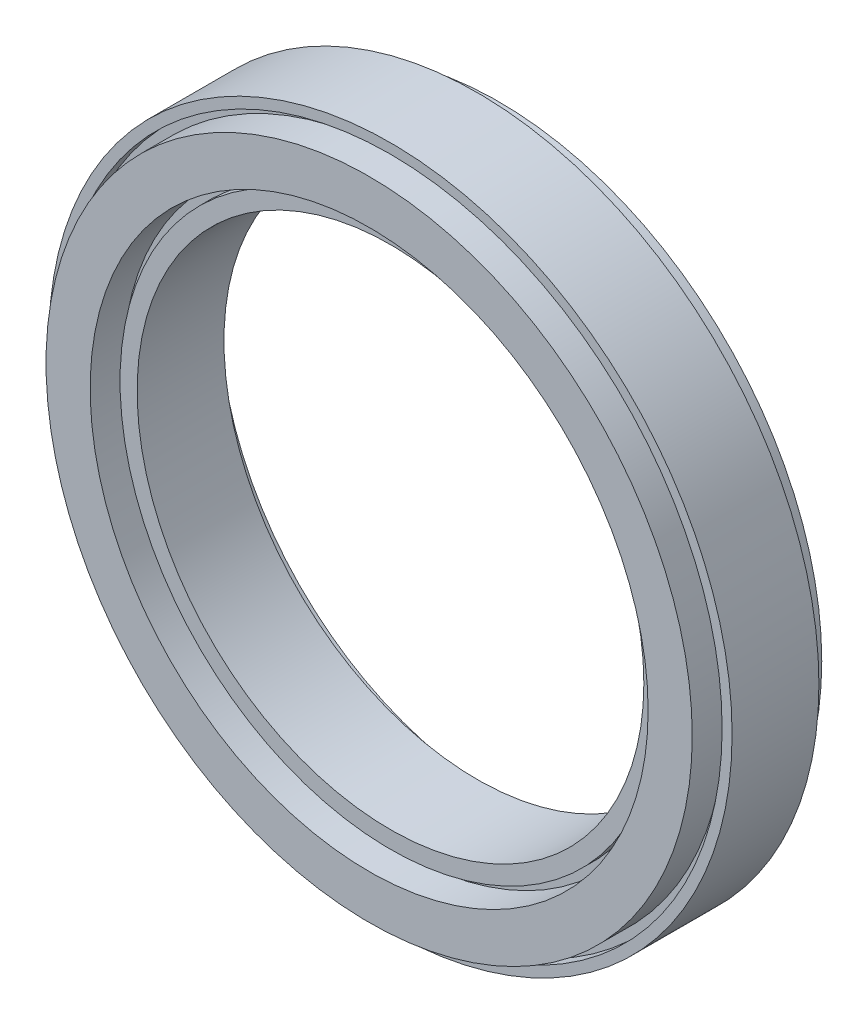
from build123d import *

# Parameters (mm, degrees)
SKETCH1_R           = 24
SKETCH1_R_2         = 17.8
BOSS_EXTRUDE1_DEPTH = 3.05
SKETCH2_R           = 23.3
SKETCH2_R_2         = 19
CUT_EXTRUDE1_DEPTH  = 0.8
SKETCH3_R           = 22.7
SKETCH3_R_2         = 19.6
BOSS_EXTRUDE2_DEPTH = 2.3


with BuildPart() as part:
    # Sketch1 → Boss-Extrude1 (new, symmetric)
    with BuildSketch(Plane.XY):
        Circle(SKETCH1_R)
        Circle(SKETCH1_R_2, mode=Mode.SUBTRACT)
    extrude(amount=BOSS_EXTRUDE1_DEPTH, both=True)

    # Sketch2 → Cut-Extrude1 (cut)
    with BuildSketch(Plane.XY.offset(3.05)):
        Circle(SKETCH2_R)
        Circle(SKETCH2_R_2, mode=Mode.SUBTRACT)
    cut_extrude1 = extrude(amount=-CUT_EXTRUDE1_DEPTH, mode=Mode.SUBTRACT)

    # Sketch3 → Boss-Extrude2 (add)
    with BuildSketch(Plane.XY.offset(2.25)):
        Circle(SKETCH3_R)
        Circle(SKETCH3_R_2, mode=Mode.SUBTRACT)
    boss_extrude2 = extrude(amount=BOSS_EXTRUDE2_DEPTH)

    # Mirror1: Cut-Extrude1, Boss-Extrude2 across plane
    add(cut_extrude1.mirror(Plane.XY), mode=Mode.SUBTRACT)
    add(boss_extrude2.mirror(Plane.XY))


solid = part.part
